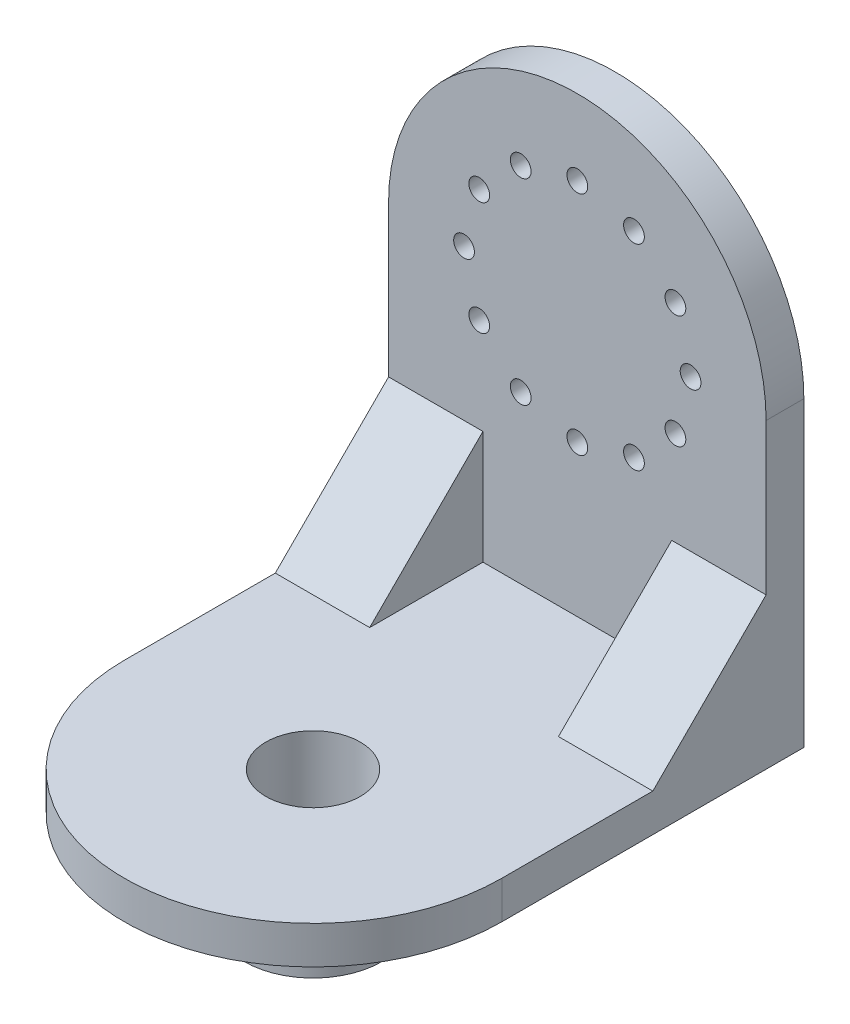
from build123d import *

# Parameters (mm, degrees)
EXTRUDE_1_DEPTH     = 10
EXTRUDE_2_DEPTH     = 10
EXTRUDE_3_DEPTH     = 25
EXTRUDE_4_DEPTH     = 25
SKETCH_5_R          = 2.75
CUT_EXTRUDE_1_DEPTH = 25
SKETCH_6_R          = 18.25
SKETCH_6_R_2        = 12.5
EXTRUDE_5_DEPTH     = 25
CUT_EXTRUDE_START   = -10
SKETCH_7_R          = 12.5
CUT_EXTRUDE_2_DEPTH = 10


with BuildPart() as part:
    # 草图1 → 凸台-拉伸1 (new body)
    with BuildSketch(Plane.XY):
        with BuildLine():
            Line((-50, 0), (-50, -80))
            Line((-50, -80), (50, -80))
            Line((50, -80), (50, 0))
            ThreePointArc((50, 0), (0, 50), (-50, 0))
        make_face()
    extrude(amount=EXTRUDE_1_DEPTH)

    # 草图2 → 凸台-拉伸2 (add)
    with BuildSketch(Plane.XZ.offset(80)):
        with BuildLine():
            Line((50, 10), (50, 80))
            ThreePointArc((50, 80), (0, 130), (-50, 80))
            Line((-50, 80), (-50, 10))
            Line((-50, 10), (50, 10))
        make_face()
    extrude(amount=-EXTRUDE_2_DEPTH)

    # 草图3 → 凸台-拉伸3 (add)
    with BuildSketch(Plane.ZY.offset(50)):
        Polygon((10, -40), (40, -70), (10, -70), align=None)
    extrude(amount=-EXTRUDE_3_DEPTH)

    # 草图4 → 凸台-拉伸4 (add)
    with BuildSketch(Plane(origin=(50, 0, 0), x_dir=(0, 0, -1), z_dir=(1, 0, 0))):
        Polygon((-10, -70), (-10, -40), (-40, -70), align=None)
    extrude(amount=-EXTRUDE_4_DEPTH)

    # 草图5 → 切除-拉伸1 (cut)
    with BuildSketch(Plane.XY.offset(10)):
        with Locations((0, 30)):
            Circle(SKETCH_5_R)
        with Locations((30, 0)):
            Circle(SKETCH_5_R)
        with Locations((0, -30)):
            Circle(SKETCH_5_R)
        with Locations((-30, 0)):
            Circle(SKETCH_5_R)
        with Locations((15, 25.980762114)):
            Circle(SKETCH_5_R)
        with Locations((25.980762114, 15)):
            Circle(SKETCH_5_R)
        with Locations((15, -25.980762114)):
            Circle(SKETCH_5_R)
        with Locations((25.980762114, -15)):
            Circle(SKETCH_5_R)
        with Locations((-15, 25.980762114)):
            Circle(SKETCH_5_R)
        with Locations((-25.980762114, 15)):
            Circle(SKETCH_5_R)
        with Locations((-25.980762114, -15)):
            Circle(SKETCH_5_R)
        with Locations((-15, -25.980762114)):
            Circle(SKETCH_5_R)
    extrude(amount=-CUT_EXTRUDE_1_DEPTH, mode=Mode.SUBTRACT)

    # 草图6 → 凸台-拉伸5 (add)
    with BuildSketch(Plane.XZ.offset(80)):
        with Locations(Location((0, 80, 0), (0, 0, 90))):
            Circle(SKETCH_6_R)
        with Locations(Location((0, 80, 0), (0, 0, 270))):
            Circle(SKETCH_6_R_2, mode=Mode.SUBTRACT)
    extrude(amount=EXTRUDE_5_DEPTH)

    # 草图7 → 切除-拉伸2 (cut)
    with BuildSketch(Plane.XZ.offset(80).offset(CUT_EXTRUDE_START)):
        with Locations(Location((0, 80, 0), (0, 0, 270))):
            Circle(SKETCH_7_R)
    extrude(amount=CUT_EXTRUDE_2_DEPTH, mode=Mode.SUBTRACT)


solid = part.part
